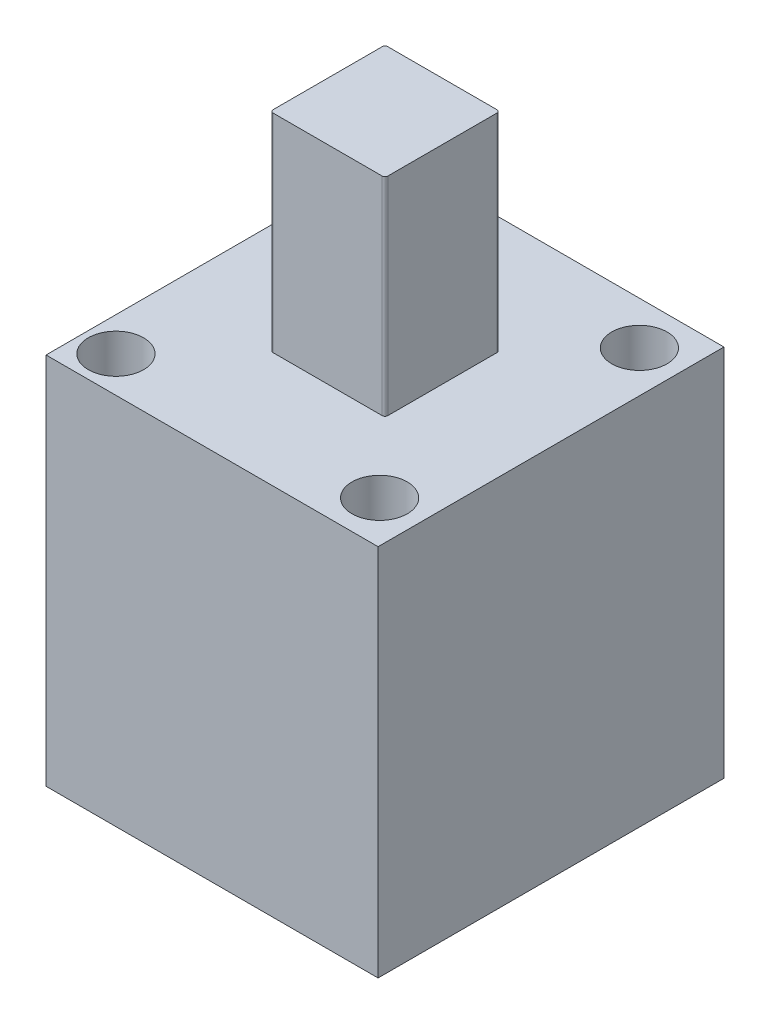
from build123d import *

# Parameters (mm, degrees)
CROQUIS1_W              = 24
CROQUIS1_H              = 27
SALIENTE_EXTRUIR1_DEPTH = 25
SALIENTE_EXTRUIR2_DEPTH = 15
CROQUIS5_R              = 2
CORTAR_EXTRUIR1_DEPTH   = 27


with BuildPart() as part:
    # Croquis1 → Saliente-Extruir1 (new body)
    with BuildSketch(Plane.XY):
        with Locations((-37, 0.422764228)):
            Rectangle(CROQUIS1_W, CROQUIS1_H)
    extrude(amount=SALIENTE_EXTRUIR1_DEPTH)

    # Croquis2 → Saliente-Extruir2 (add)
    with BuildSketch(Plane(origin=(0, 13.922764228, 0), x_dir=(1, 0, 0), z_dir=(0, 1, 0))):
        with BuildLine():
            Line((-40.95, -8.35), (-33.05, -8.35))
            ThreePointArc((-33.05, -8.35), (-32.908578644, -8.408578644), (-32.85, -8.55))
            Line((-32.85, -8.55), (-32.85, -16.45))
            ThreePointArc((-32.85, -16.45), (-32.908578644, -16.591421356), (-33.05, -16.65))
            Line((-33.05, -16.65), (-40.95, -16.65))
            ThreePointArc((-40.95, -16.65), (-41.091421356, -16.591421356), (-41.15, -16.45))
            Line((-41.15, -16.45), (-41.15, -8.55))
            ThreePointArc((-41.15, -8.55), (-41.091421356, -8.408578644), (-40.95, -8.35))
        make_face()
    extrude(amount=SALIENTE_EXTRUIR2_DEPTH)

    # Croquis5 → Cortar-Extruir1 (cut)
    with BuildSketch(Plane(origin=(0, 13.922764228, 0), x_dir=(1, 0, 0), z_dir=(0, 1, 0))):
        with Locations(Location((-46.551489219, -22.396688282, 0), (0, 0, 270))):
            Circle(CROQUIS5_R)
        with Locations(Location((-28, -21.888198758, 0), (0, 0, 270))):
            Circle(CROQUIS5_R)
        with Locations(Location((-46, -3.267515924, 0), (0, 0, 270))):
            Circle(CROQUIS5_R)
        with Locations(Location((-28, -3.111801242, 0), (0, 0, 270))):
            Circle(CROQUIS5_R)
    extrude(amount=-CORTAR_EXTRUIR1_DEPTH, mode=Mode.SUBTRACT)


solid = part.part
